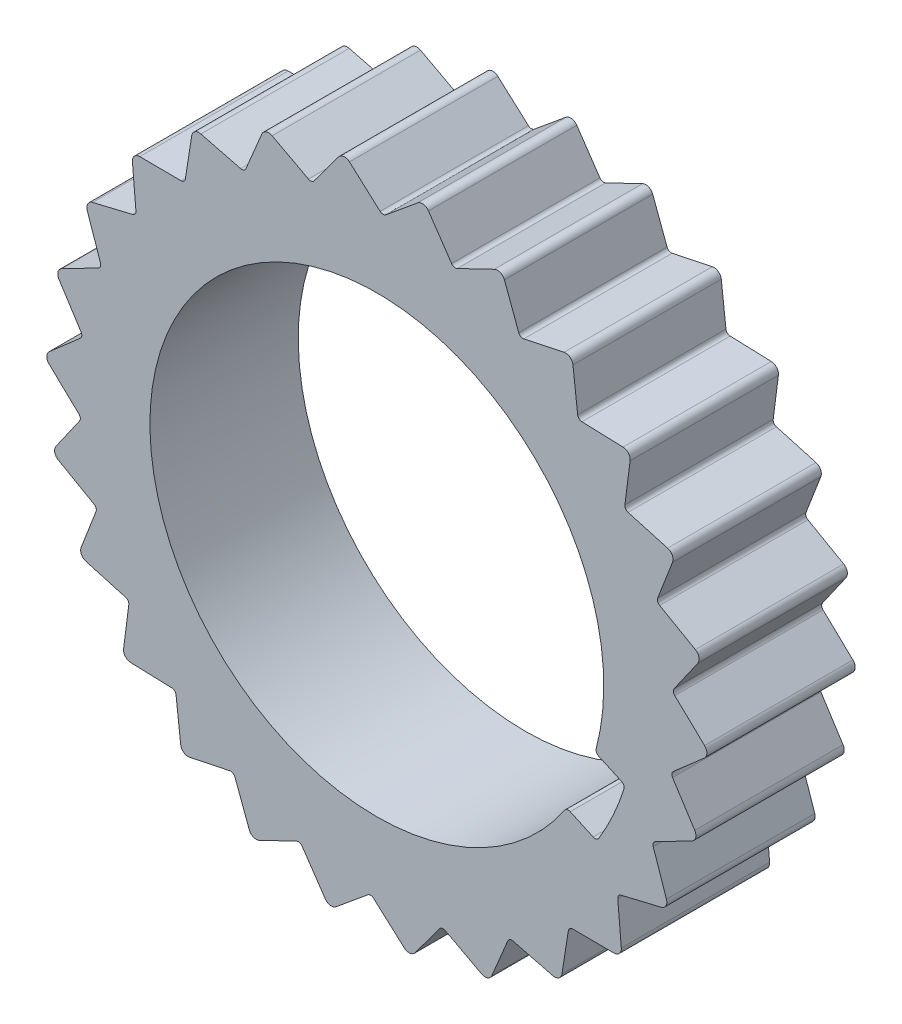
from build123d import *

# Parameters (mm, degrees)
BOSS_EXTRU_1_DEPTH = 10


with BuildPart() as part:
    # Esquisse1 → Boss.-Extru.1 (new body)
    with BuildSketch(Plane.XY):
        with BuildLine():
            Line((19.936371996, 9.53093454), (18.936003853, 6.945485686))
            ThreePointArc((18.936003853, 6.945485686), (18.933149277, 6.736662361), (19.067266911, 6.576575542))
            Line((19.067266911, 6.576575542), (21.475916438, 5.204099801))
            ThreePointArc((21.475916438, 5.204099801), (21.716214662, 4.879285253), (21.63795919, 4.482896797))
            Line((21.63795919, 4.482896797), (20.047921516, 2.211980154))
            ThreePointArc((20.047921516, 2.211980154), (19.995175197, 2.009908), (20.087084333, 1.822376562))
            Line((20.087084333, 1.822376562), (22.097287938, -0.08664509))
            ThreePointArc((22.097287938, -0.08664509), (22.252870323, -0.459528247), (22.082026846, -0.825670614))
            Line((22.082026846, -0.825670614), (19.994726852, -2.650077625))
            ThreePointArc((19.994726852, -2.650077625), (19.895154214, -2.833654908), (19.939513426, -3.03773232))
            Line((19.939513426, -3.03773232), (21.434445383, -5.372354483))
            ThreePointArc((21.434445383, -5.372354483), (21.496270047, -5.771635635), (21.242767367, -6.08625305))
            Line((21.242767367, -6.08625305), (18.779511342, -7.358122524))
            ThreePointArc((18.779511342, -7.358122524), (18.638899183, -7.512536093), (18.633130477, -7.72129924))
            Line((18.633130477, -7.72129924), (19.525910774, -10.345842161))
            ThreePointArc((19.525910774, -10.345842161), (19.490384691, -10.748316538), (19.168955462, -10.993124582))
            Line((19.168955462, -10.993124582), (16.472898893, -11.638540088))
            ThreePointArc((16.472898893, -11.638540088), (16.299419082, -11.754815988), (16.243857712, -11.956132315))
            Line((16.243857712, -11.956132315), (16.482601205, -14.718067098))
            ThreePointArc((16.482601205, -14.718067098), (16.351789022, -15.100344354), (15.981113543, -15.261115671))
            Line((15.981113543, -15.261115671), (13.208941437, -15.242568007))
            ThreePointArc((13.208941437, -15.242568007), (13.01267599, -15.313948704), (12.910550982, -15.496118438))
            Line((12.910550982, -15.496118438), (12.481382765, -18.234931474))
            ThreePointArc((12.481382765, -18.234931474), (12.262886811, -18.574795043), (11.864507393, -18.642186189))
            Line((11.864507393, -18.642186189), (9.177328317, -17.960753277))
            ThreePointArc((9.177328317, -17.960753277), (8.969683468, -17.983090385), (8.826929956, -18.135526484))
            Line((8.826929956, -18.135526484), (7.754791727, -20.692047914))
            ThreePointArc((7.754791727, -20.692047914), (7.461310193, -20.96974616), (7.0583792, -20.939840607))
            Line((7.0583792, -20.939840607), (4.612362234, -19.635124852))
            ThreePointArc((4.612362234, -19.635124852), (4.405405547, -19.607120219), (4.230319846, -19.720963651))
            Line((4.230319846, -19.720963651), (2.577520381, -21.946617741))
            ThreePointArc((2.577520381, -21.946617741), (2.226109347, -22.146011853), (1.842043663, -22.020547603))
            Line((1.842043663, -22.020547603), (-0.220657578, -20.168374341))
            ThreePointArc((-0.220657578, -20.168374341), (-0.414898532, -20.091655495), (-0.612141077, -20.160290093))
            Line((-0.612141077, -20.160290093), (-2.74954708, -21.925729918))
            ThreePointArc((-2.74954708, -21.925729918), (-3.138464883, -22.035231834), (-3.481344755, -21.821500413))
            Line((-3.481344755, -21.821500413), (-5.040853572, -19.529511222))
            ThreePointArc((-5.040853572, -19.529511222), (-5.211090216, -19.408536784), (-5.419026585, -19.427973754))
            Line((-5.419026585, -19.427973754), (-7.91682086, -20.630598369))
            ThreePointArc((-7.91682086, -20.630598369), (-8.320642942, -20.643844236), (-8.602410071, -20.354266937))
            Line((-8.602410071, -20.354266937), (-9.56809348, -17.755663898))
            ThreePointArc((-9.56809348, -17.755663898), (-9.704432278, -17.597464462), (-9.910977966, -17.566574199))
            Line((-9.910977966, -17.566574199), (-12.623997787, -18.136491432))
            ThreePointArc((-12.623997787, -18.136491432), (-13.019255477, -18.052711449), (-13.223534582, -17.704117452))
            Line((-13.223534582, -17.704117452), (-13.539270574, -14.949921928))
            ThreePointArc((-13.539270574, -14.949921928), (-13.633788011, -14.76369147), (-13.826939332, -14.684269203))
            Line((-13.826939332, -14.684269203), (-16.597513849, -14.588357536))
            ThreePointArc((-16.597513849, -14.588357536), (-16.961236207, -14.41242069), (-17.076155328, -14.025069012))
            Line((-17.076155328, -14.025069012), (-16.723594475, -11.275344836))
            ThreePointArc((-16.723594475, -11.275344836), (-16.770797541, -11.071906393), (-16.939329244, -10.948567856))
            Line((-16.939329244, -10.948567856), (-19.606442736, -10.192401327))
            ThreePointArc((-19.606442736, -10.192401327), (-19.91749154, -9.934532429), (-19.936371996, -9.53093454))
            Line((-19.936371996, -9.53093454), (-18.936003853, -6.945485686))
            ThreePointArc((-18.936003853, -6.945485686), (-18.933149277, -6.736662361), (-19.067266911, -6.576575542))
            Line((-19.067266911, -6.576575542), (-21.475916438, -5.204099801))
            ThreePointArc((-21.475916438, -5.204099801), (-21.716214662, -4.879285253), (-21.63795919, -4.482896797))
            Line((-21.63795919, -4.482896797), (-20.047921516, -2.211980154))
            ThreePointArc((-20.047921516, -2.211980154), (-19.995175197, -2.009908), (-20.087084333, -1.822376562))
            Line((-20.087084333, -1.822376562), (-22.097287938, 0.08664509))
            ThreePointArc((-22.097287938, 0.08664509), (-22.252870323, 0.459528247), (-22.082026846, 0.825670614))
            Line((-22.082026846, 0.825670614), (-19.994726852, 2.650077625))
            ThreePointArc((-19.994726852, 2.650077625), (-19.895154214, 2.833654908), (-19.939513426, 3.03773232))
            Line((-19.939513426, 3.03773232), (-21.434445383, 5.372354483))
            ThreePointArc((-21.434445383, 5.372354483), (-21.496270047, 5.771635635), (-21.242767367, 6.08625305))
            Line((-21.242767367, 6.08625305), (-18.779511342, 7.358122524))
            ThreePointArc((-18.779511342, 7.358122524), (-18.638899183, 7.512536093), (-18.633130477, 7.72129924))
            Line((-18.633130477, 7.72129924), (-19.525910774, 10.345842161))
            ThreePointArc((-19.525910774, 10.345842161), (-19.490384691, 10.748316538), (-19.168955462, 10.993124582))
            Line((-19.168955462, 10.993124582), (-16.472898893, 11.638540088))
            ThreePointArc((-16.472898893, 11.638540088), (-16.299419082, 11.754815988), (-16.243857712, 11.956132315))
            Line((-16.243857712, 11.956132315), (-16.482601205, 14.718067098))
            ThreePointArc((-16.482601205, 14.718067098), (-16.351789022, 15.100344354), (-15.981113543, 15.261115671))
            Line((-15.981113543, 15.261115671), (-13.208941437, 15.242568007))
            ThreePointArc((-13.208941437, 15.242568007), (-13.01267599, 15.313948704), (-12.910550982, 15.496118438))
            Line((-12.910550982, 15.496118438), (-12.481382765, 18.234931474))
            ThreePointArc((-12.481382765, 18.234931474), (-12.262886811, 18.574795043), (-11.864507393, 18.642186189))
            Line((-11.864507393, 18.642186189), (-9.177328317, 17.960753277))
            ThreePointArc((-9.177328317, 17.960753277), (-8.969683468, 17.983090385), (-8.826929956, 18.135526484))
            Line((-8.826929956, 18.135526484), (-7.754791727, 20.692047914))
            ThreePointArc((-7.754791727, 20.692047914), (-7.461310193, 20.96974616), (-7.0583792, 20.939840607))
            Line((-7.0583792, 20.939840607), (-4.612362234, 19.635124852))
            ThreePointArc((-4.612362234, 19.635124852), (-4.405405547, 19.607120219), (-4.230319846, 19.720963651))
            Line((-4.230319846, 19.720963651), (-2.577520381, 21.946617741))
            ThreePointArc((-2.577520381, 21.946617741), (-2.226109347, 22.146011853), (-1.842043663, 22.020547603))
            Line((-1.842043663, 22.020547603), (0.220657578, 20.168374341))
            ThreePointArc((0.220657578, 20.168374341), (0.414898532, 20.091655495), (0.612141077, 20.160290093))
            Line((0.612141077, 20.160290093), (2.74954708, 21.925729918))
            ThreePointArc((2.74954708, 21.925729918), (3.138464883, 22.035231834), (3.481344755, 21.821500413))
            Line((3.481344755, 21.821500413), (5.040853572, 19.529511222))
            ThreePointArc((5.040853572, 19.529511222), (5.211090216, 19.408536784), (5.419026585, 19.427973754))
            Line((5.419026585, 19.427973754), (7.91682086, 20.630598369))
            ThreePointArc((7.91682086, 20.630598369), (8.320642942, 20.643844236), (8.602410071, 20.354266937))
            Line((8.602410071, 20.354266937), (9.56809348, 17.755663898))
            ThreePointArc((9.56809348, 17.755663898), (9.704432278, 17.597464462), (9.910977966, 17.566574199))
            Line((9.910977966, 17.566574199), (12.623997787, 18.136491432))
            ThreePointArc((12.623997787, 18.136491432), (13.019255477, 18.052711449), (13.223534582, 17.704117452))
            Line((13.223534582, 17.704117452), (13.539270574, 14.949921928))
            ThreePointArc((13.539270574, 14.949921928), (13.633788011, 14.76369147), (13.826939332, 14.684269203))
            Line((13.826939332, 14.684269203), (16.597513849, 14.588357536))
            ThreePointArc((16.597513849, 14.588357536), (16.961236207, 14.41242069), (17.076155328, 14.025069012))
            Line((17.076155328, 14.025069012), (16.723594475, 11.275344836))
            ThreePointArc((16.723594475, 11.275344836), (16.770797541, 11.071906393), (16.939329244, 10.948567856))
            Line((16.939329244, 10.948567856), (19.606442736, 10.192401327))
            ThreePointArc((19.606442736, 10.192401327), (19.91749154, 9.934532429), (19.936371996, 9.53093454))
        make_face()
        with BuildLine():
            Line((14.953030626, -4.277181575), (16.501758042, -4.982426557))
            ThreePointArc((16.501758042, -4.982426557), (16.651785463, -5.134087079), (16.663083329, -5.347116418))
            ThreePointArc((16.663083329, -5.347116418), (15.924531384, -7.256672806), (14.968008895, -9.066901881))
            ThreePointArc((14.968008895, -9.066901881), (14.799864591, -9.198133844), (14.587009397, -9.184458985))
            Line((14.587009397, -9.184458985), (13.038282108, -8.478683252))
            ThreePointArc((13.038282108, -8.478683252), (12.832759155, -8.462847948), (12.665533258, -8.583371557))
            ThreePointArc((12.665533258, -8.583371557), (-13.922503409, 6.344596033), (14.787409001, -3.927153556))
            ThreePointArc((14.787409001, -3.927153556), (14.806182583, -4.132467854), (14.953030626, -4.277181575))
        make_face(mode=Mode.SUBTRACT)
    extrude(amount=BOSS_EXTRU_1_DEPTH)


solid = part.part
